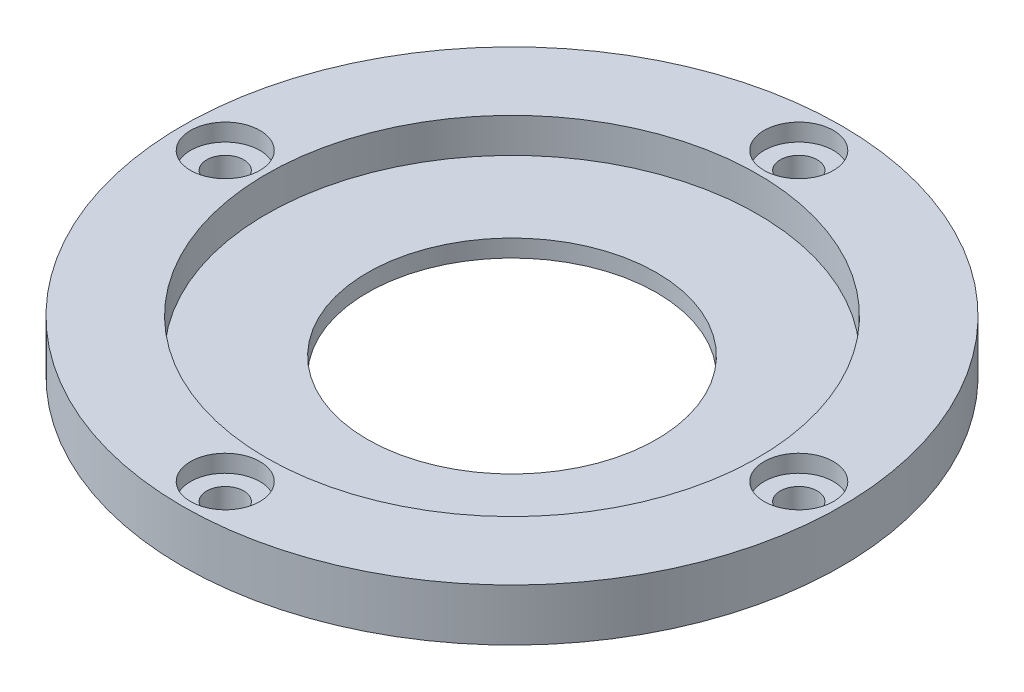
from build123d import *

# Parameters (mm, degrees)
SKETCH_1_R          = 28.5
SKETCH_1_R_2        = 12.5
EXTRUDE_1_DEPTH     = 1.5
SKETCH_2_R          = 28.5
SKETCH_2_R_2        = 21.25
EXTRUDE_2_DEPTH     = 3
SKETCH_3_R          = 3
CUT_EXTRUDE_1_DEPTH = 1.5
SKETCH_4_R          = 1.6
CUT_EXTRUDE_2_DEPTH = 41.416580756


with BuildPart() as part:
    # 草图1 → 凸台-拉伸1 (new body)
    with BuildSketch(Plane(origin=(0, 0, 0), x_dir=(1, 0, 0), z_dir=(0, 1, 0))):
        with Locations(Location((0, 0, 0), (0, 0, 270))):
            Circle(SKETCH_1_R)
        with Locations(Location((0, 0, 0), (0, 0, 270))):
            Circle(SKETCH_1_R_2, mode=Mode.SUBTRACT)
    extrude(amount=EXTRUDE_1_DEPTH)

    # 草图2 → 凸台-拉伸2 (add)
    with BuildSketch(Plane(origin=(0, 1.5, 0), x_dir=(1, 0, 0), z_dir=(0, 1, 0))):
        with Locations(Location((0, 0, 0), (0, 0, 270))):
            Circle(SKETCH_2_R)
        with Locations(Location((0, 0, 0), (0, 0, 270))):
            Circle(SKETCH_2_R_2, mode=Mode.SUBTRACT)
    extrude(amount=EXTRUDE_2_DEPTH)

    # 草图3 → 切除-拉伸1 (cut)
    with BuildSketch(Plane(origin=(0, 4.5, 0), x_dir=(1, 0, 0), z_dir=(0, 1, 0))):
        with Locations(Location((0, 24.8, 0), (0, 0, 270))):
            Circle(SKETCH_3_R)
        with Locations(Location((24.8, 0, 0), (0, 0, 270))):
            Circle(SKETCH_3_R)
        with Locations(Location((0, -24.8, 0), (0, 0, 270))):
            Circle(SKETCH_3_R)
        with Locations(Location((-24.8, 0, 0), (0, 0, 270))):
            Circle(SKETCH_3_R)
    extrude(amount=-CUT_EXTRUDE_1_DEPTH, mode=Mode.SUBTRACT)

    # 草图4 → 切除-拉伸2 (cut, through all)
    with BuildSketch(Plane(origin=(0, 3, 0), x_dir=(1, 0, 0), z_dir=(0, 1, 0))):
        with Locations(Location((0, 24.8, 0), (0, 0, 270))):
            Circle(SKETCH_4_R)
        with Locations(Location((24.8, 0, 0), (0, 0, 270))):
            Circle(SKETCH_4_R)
        with Locations(Location((0, -24.8, 0), (0, 0, 270))):
            Circle(SKETCH_4_R)
        with Locations(Location((-24.8, 0, 0), (0, 0, 270))):
            Circle(SKETCH_4_R)
    extrude(amount=-CUT_EXTRUDE_2_DEPTH, mode=Mode.SUBTRACT)


solid = part.part
